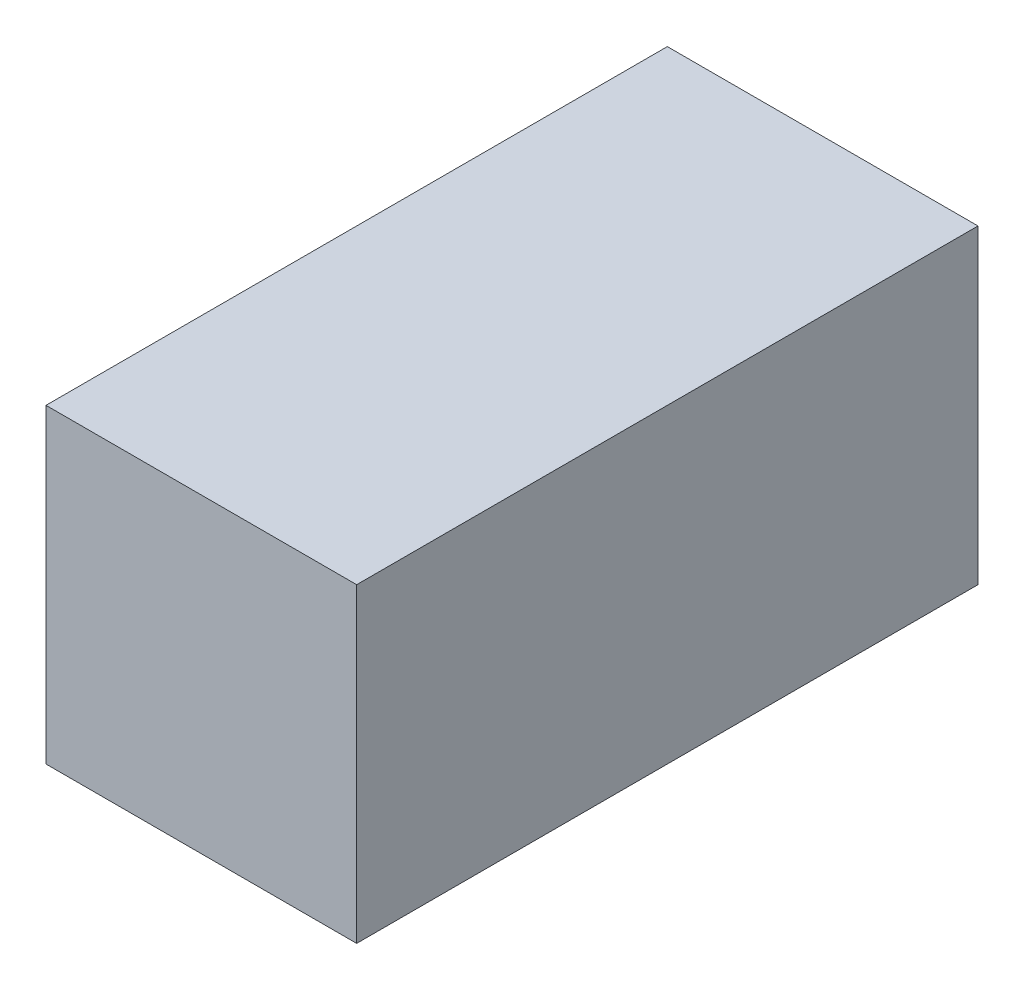
from build123d import *

# Parameters (mm, degrees)
CROQUIS1_W              = 75
CROQUIS1_H              = 75
SALIENTE_EXTRUIR1_DEPTH = 150


with BuildPart() as part:
    # Croquis1 → Saliente-Extruir1 (new body)
    with BuildSketch(Plane.XY):
        Rectangle(CROQUIS1_W, CROQUIS1_H)
    extrude(amount=SALIENTE_EXTRUIR1_DEPTH)


solid = part.part
